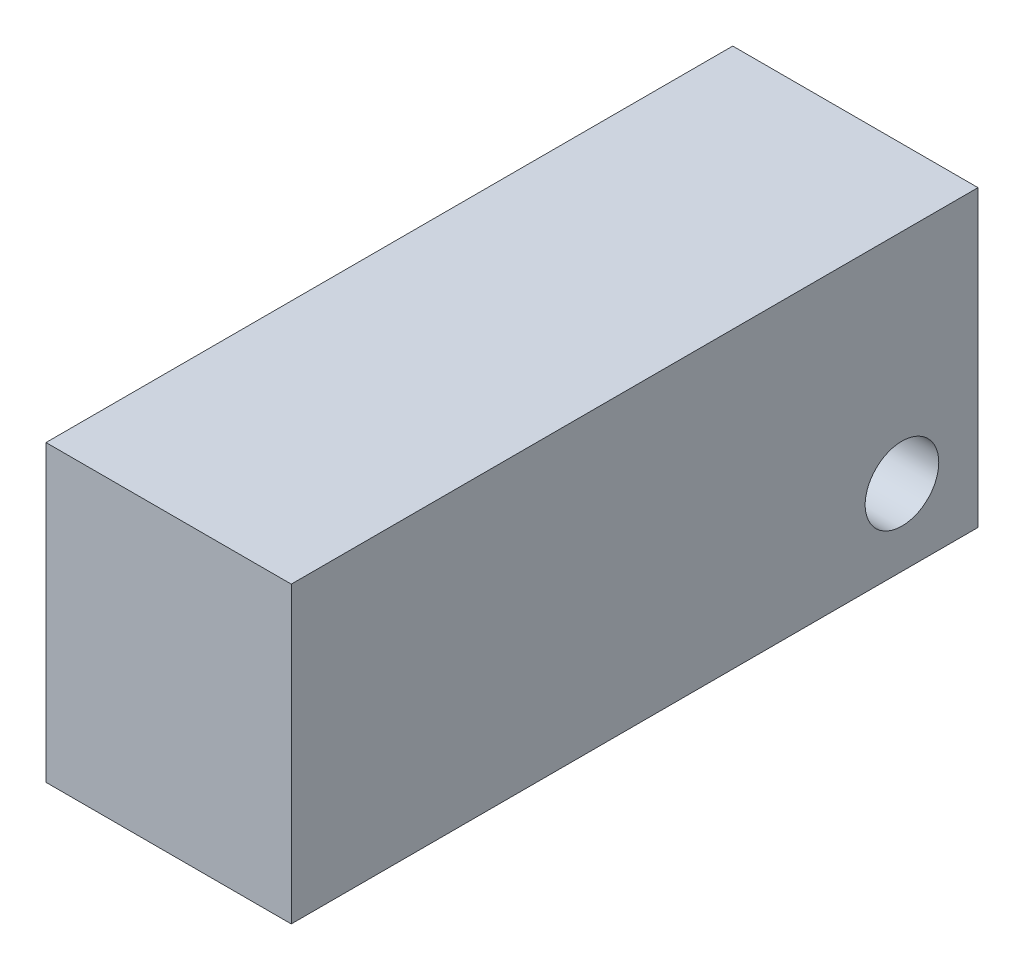
from build123d import *

# Parameters (mm, degrees)
SKETCH_1_W      = 28
SKETCH_1_H      = 12
SKETCH_1_R      = 1.5
EXTRUDE_1_DEPTH = 10


with BuildPart() as part:
    # 草图1 → 凸台-拉伸1 (new body)
    with BuildSketch(Plane(origin=(0, 0, 0), x_dir=(0, 0, -1), z_dir=(1, 0, 0))):
        with Locations((-14, 6)):
            Rectangle(SKETCH_1_W, SKETCH_1_H)
        with Locations((-3.1, 3.1)):
            Circle(SKETCH_1_R, mode=Mode.SUBTRACT)
    extrude(amount=EXTRUDE_1_DEPTH)


solid = part.part
